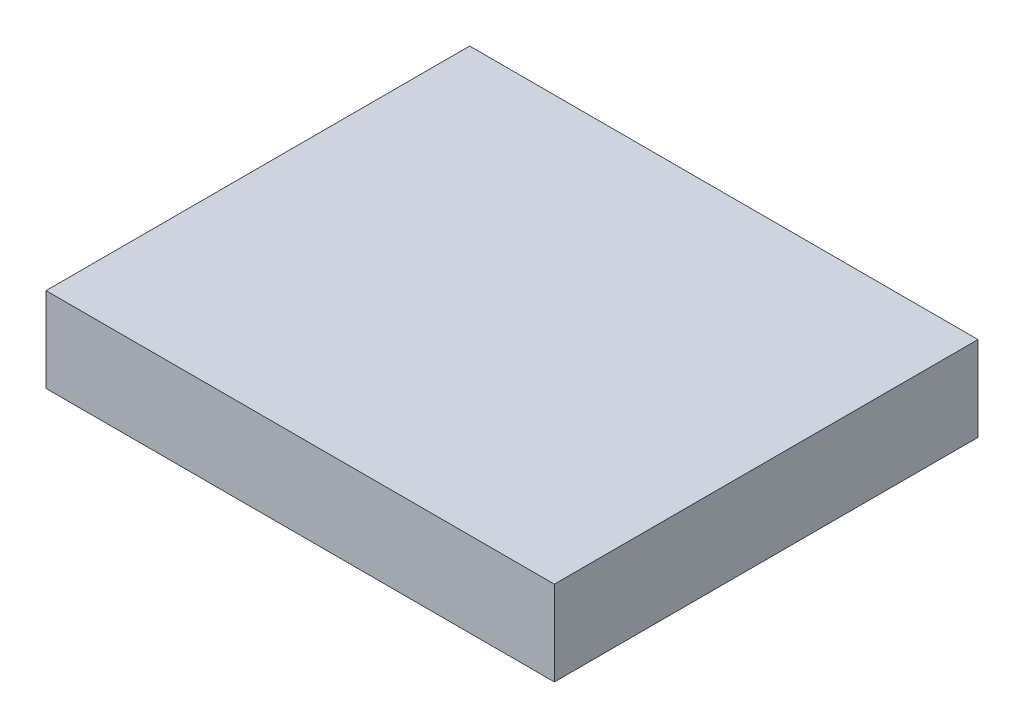
from build123d import *

# Parameters (mm, degrees)
SKETCH1_W           = 30
SKETCH1_H           = 25
BOSS_EXTRUDE1_DEPTH = 5


with BuildPart() as part:
    # Sketch1 → Boss-Extrude1 (new body)
    with BuildSketch(Plane(origin=(0, 0, 0), x_dir=(1, 0, 0), z_dir=(0, 1, 0))):
        with Locations((15, 12.5)):
            Rectangle(SKETCH1_W, SKETCH1_H)
    extrude(amount=BOSS_EXTRUDE1_DEPTH)


solid = part.part
